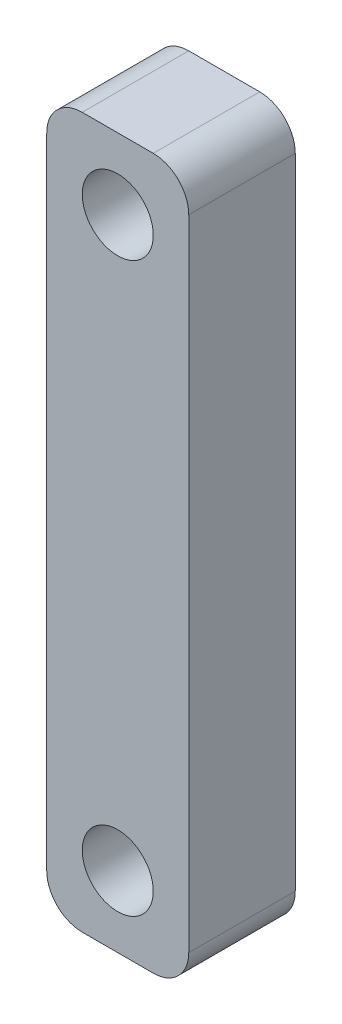
from build123d import *

# Parameters (mm, degrees)
ESQUISSE1_W             = 4
ESQUISSE1_H             = 20
BOSS_EXTRU_1_DEPTH      = 3
ESQUISSE3_R             = 1
ENL_V_MAT_EXTRU_1_DEPTH = 6
CONG_4_R                = 1
CONG_5_R                = 1
CONG_6_R                = 1
CONG_7_R                = 1


with BuildPart() as part:
    # Esquisse1 → Boss.-Extru.1 (new body)
    with BuildSketch(Plane.XY):
        with Locations((2, 10)):
            Rectangle(ESQUISSE1_W, ESQUISSE1_H)
    extrude(amount=BOSS_EXTRU_1_DEPTH)

    # Esquisse3 → Enlèv. mat.-Extru.1 (cut)
    with BuildSketch(Plane.XY.offset(3)):
        with Locations((2, 2)):
            Circle(ESQUISSE3_R)
        with Locations((2, 18)):
            Circle(ESQUISSE3_R)
    extrude(amount=-ENL_V_MAT_EXTRU_1_DEPTH, mode=Mode.SUBTRACT)

    # Congé4
    cong_4_edges = [part.edges().sort_by_distance(p)[0] for p in [
        (4, 0, 1.5),
    ]]
    fillet(cong_4_edges, radius=CONG_4_R)

    # Congé5
    cong_5_edges = [part.edges().sort_by_distance(p)[0] for p in [
        (0, 0, 1.5),
    ]]
    fillet(cong_5_edges, radius=CONG_5_R)

    # Congé6
    cong_6_edges = [part.edges().sort_by_distance(p)[0] for p in [
        (0, 20, 1.5),
    ]]
    fillet(cong_6_edges, radius=CONG_6_R)

    # Congé7
    cong_7_edges = [part.edges().sort_by_distance(p)[0] for p in [
        (4, 20, 1.5),
    ]]
    fillet(cong_7_edges, radius=CONG_7_R)


solid = part.part
